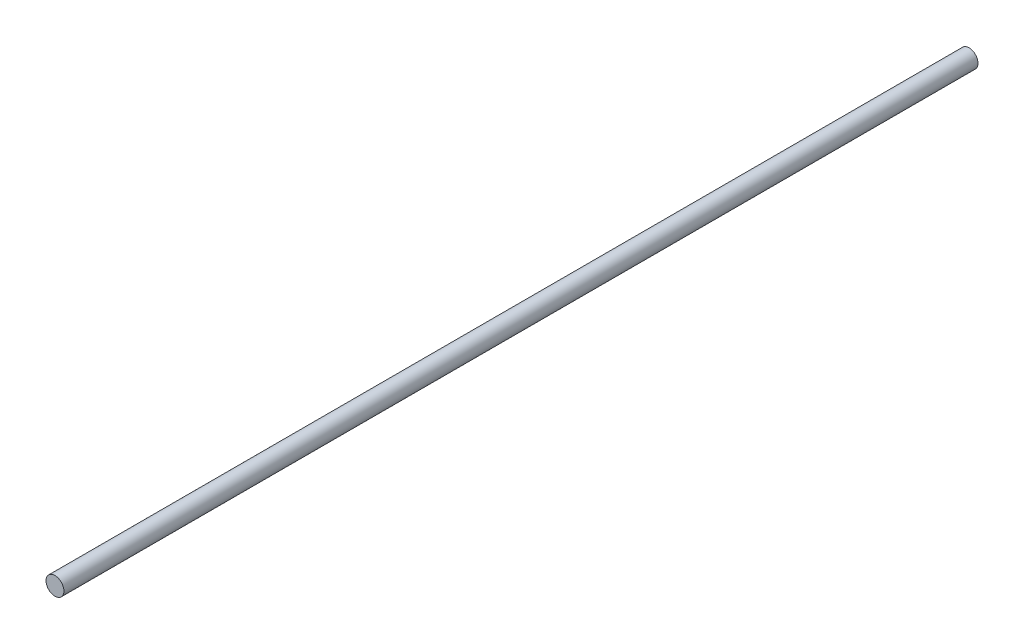
from build123d import *

# Parameters (mm, degrees)
SKETCH2_R           = 5
BOSS_EXTRUDE1_DEPTH = 510


with BuildPart() as part:
    # Sketch2 → Boss-Extrude1 (new body)
    with BuildSketch(Plane(origin=(0, 0, 0), x_dir=(-0.8404561370040742, -0.5418795823540402, 0), z_dir=(0, 0, 1))):
        with Locations(Location((-224.080156548, 95.246425529, 0), (0, 0, 57.188317949))):
            Circle(SKETCH2_R)
    extrude(amount=BOSS_EXTRUDE1_DEPTH)


solid = part.part
